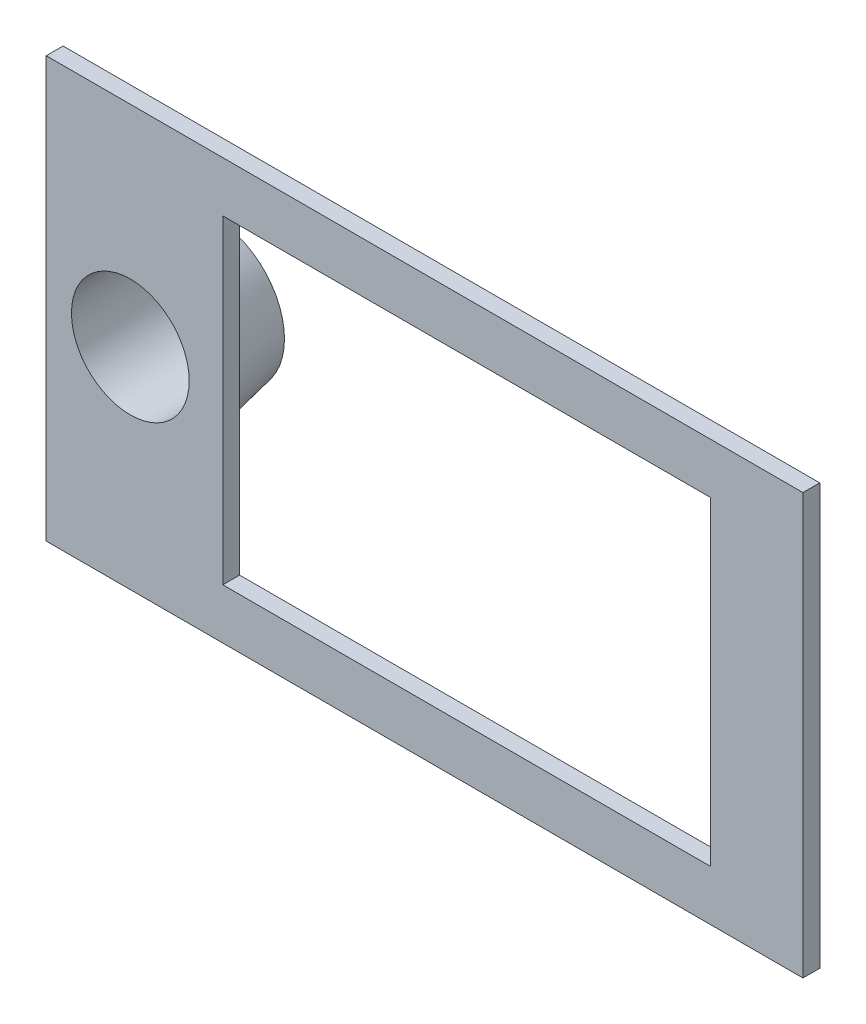
from build123d import *

# Parameters (mm, degrees)
SKETCH_1_W          = 135
SKETCH_1_H          = 75
SKETCH_1_R          = 10.5
SKETCH_1_W_2        = 87
SKETCH_1_H_2        = 57
EXTRUDE_1_DEPTH     = 3
SKETCH_5_R          = 15
SKETCH_4_R          = 12.5
CUT_EXTRUDE_1_REACH = 171.52
SKETCH_5_93_R       = 10.5


with BuildPart() as part:
    # 草图1 → 凸台-拉伸1 (new body)
    with BuildSketch(Plane(origin=(0, 0, 826.316112651), x_dir=(-1, 0, 0), z_dir=(0, 0, -1))):
        with Locations((-85.5, 34.5)):
            Rectangle(SKETCH_1_W, SKETCH_1_H)
        with Locations((-33, 34.5)):
            Circle(SKETCH_1_R, mode=Mode.SUBTRACT)
        with Locations((-93, 34.5)):
            Rectangle(SKETCH_1_W_2, SKETCH_1_H_2, mode=Mode.SUBTRACT)
    extrude(amount=EXTRUDE_1_DEPTH)

    # 草图5 → 放样4 section 0
    with BuildSketch(Plane(origin=(0, 0, 823.316112651), x_dir=(-1, 0, 0), z_dir=(0, 0, -1))):
        with Locations((-33, 34.5)):
            Circle(SKETCH_5_R)
    # 草图4 → 放样4 section 1
    with BuildSketch(Plane.XY.offset(811.316112651)):
        with Locations((33, 34.5)):
            Circle(SKETCH_4_R)
    loft()

    # 草图5<93> → 切除-拉伸1 (cut, up to next)
    with BuildSketch(Plane(origin=(0, 0, 823.316112651), x_dir=(-1, 0, 0), z_dir=(0, 0, -1)), mode=Mode.PRIVATE) as cut_extrude_1_sk1:
        with Locations(Location((-33, 34.5, 0), (0, 0, 180))):
            Circle(SKETCH_5_93_R)
    cut_extrude_1_tool1 = extrude(cut_extrude_1_sk1.sketch, amount=CUT_EXTRUDE_1_REACH, mode=Mode.PRIVATE) & part.part
    add(cut_extrude_1_tool1.solids().sort_by_distance((33, 34.5, 823.316113))[0], mode=Mode.SUBTRACT)


solid = part.part
